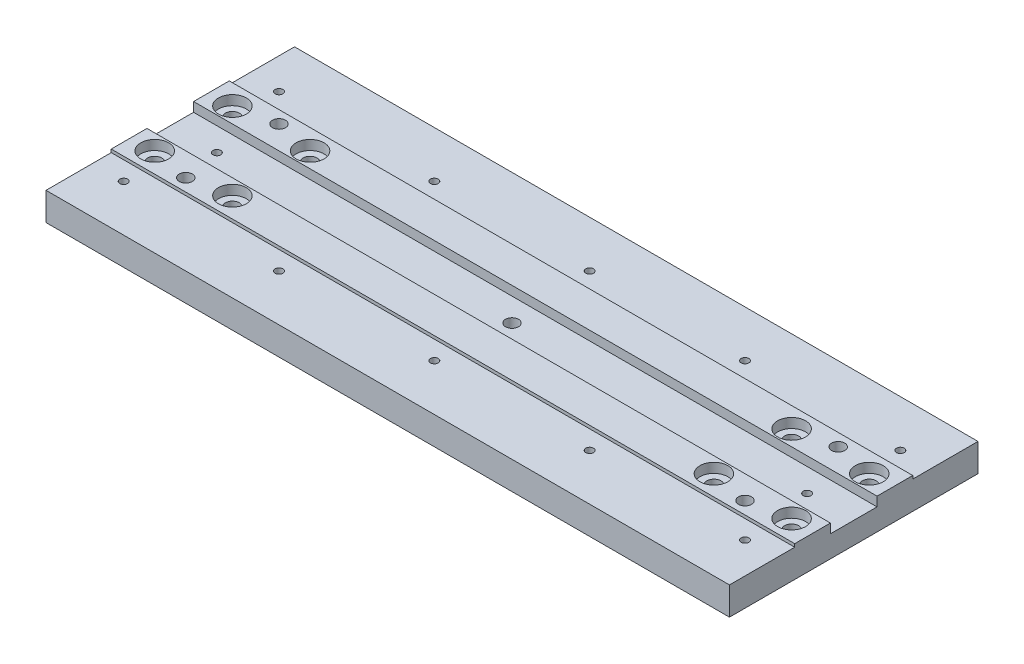
from build123d import *

# Parameters (mm, degrees)
SKIZZE1_W                                            = 220
SKIZZE1_H                                            = 80
AUFSATZ_LINEAR_AUSTRAGEN1_DEPTH                      = 10
STIRNSENKUNG_F_R_M4_FLACHKOPFSCHRAUBE_MI_D           = 4.5
STIRNSENKUNG_F_R_M4_FLACHKOPFSCHRAUBE_MI_DEPTH       = 11.5
STIRNSENKUNG_F_R_M4_FLACHKOPFSCHRAUBE_MI_CBORE_D     = 9
STIRNSENKUNG_F_R_M4_FLACHKOPFSCHRAUBE_MI_CBORE_DEPTH = 3.1
STIRNSENKUNG_F_R_M4_FLACHKOPFSCHRAUBE_MI_TIP         = 1.351936393
M3_GEWINDEBOHRUNG1_AT_2_COUNT                        = 2
M3_GEWINDEBOHRUNG1_AT_2_PITCH                        = 50
M3_GEWINDEBOHRUNG1_AT_3_COUNT                        = 2
M3_GEWINDEBOHRUNG1_AT_3_PITCH                        = 100
M3_GEWINDEBOHRUNG1_AT_4_COUNT                        = 2
M3_GEWINDEBOHRUNG1_AT_4_PITCH                        = 150
M3_GEWINDEBOHRUNG1_AT_5_COUNT                        = 2
M3_GEWINDEBOHRUNG1_AT_5_PITCH                        = 50
M3_GEWINDEBOHRUNG1_AT_6_COUNT                        = 2
M3_GEWINDEBOHRUNG1_AT_6_PITCH                        = 200
M3_GEWINDEBOHRUNG1_AT_7_COUNT                        = 2
M3_GEWINDEBOHRUNG1_AT_7_PITCH                        = 250
SKIZZE8_W                                            = 15
SKIZZE8_H                                            = 3
SCHNITT_LINEAR_AUSTRAGEN1_DEPTH                      = 224.830292856
M5_GEWINDEBOHRUNG1_D                                 = 4.2
SKIZZE13_W                                           = 220
SKIZZE13_H                                           = 21
SCHNITT_LINEAR_AUSTRAGEN2_DEPTH                      = 1
M3_GEWINDEBOHRUNG2_D                                 = 2.5


with BuildPart() as part:
    # Skizze1 → Aufsatz-Linear austragen1 (new body)
    with BuildSketch(Plane(origin=(0, 0, 0), x_dir=(1, 0, 0), z_dir=(0, 1, 0))):
        Rectangle(SKIZZE1_W, SKIZZE1_H)
    extrude(amount=AUFSATZ_LINEAR_AUSTRAGEN1_DEPTH)

    # Stirnsenkung für M4 Flachkopfschraube mit Schlitz1
    with Locations(Plane(origin=(0, 10, 0), x_dir=(1, 0, 0), z_dir=(0, 1, 0))):
        with Locations((-102.5, 12.5), (-77.5, 12.5), (-77.5, -12.5), (-102.5, -12.5), (102.5, -12.5), (77.5, -12.5), (77.5, 12.5), (102.5, 12.5)):
            CounterBoreHole(STIRNSENKUNG_F_R_M4_FLACHKOPFSCHRAUBE_MI_D / 2, STIRNSENKUNG_F_R_M4_FLACHKOPFSCHRAUBE_MI_CBORE_D / 2, STIRNSENKUNG_F_R_M4_FLACHKOPFSCHRAUBE_MI_CBORE_DEPTH, depth=STIRNSENKUNG_F_R_M4_FLACHKOPFSCHRAUBE_MI_DEPTH)
            with Locations((0, 0, -(STIRNSENKUNG_F_R_M4_FLACHKOPFSCHRAUBE_MI_DEPTH + STIRNSENKUNG_F_R_M4_FLACHKOPFSCHRAUBE_MI_TIP / 2))):  # 118° drill point
                Cone(0, STIRNSENKUNG_F_R_M4_FLACHKOPFSCHRAUBE_MI_D / 2, STIRNSENKUNG_F_R_M4_FLACHKOPFSCHRAUBE_MI_TIP, mode=Mode.SUBTRACT)

    # Skizze7 → M3 Gewindebohrung1 (revolve, cut)
    with BuildSketch(Plane(origin=(-50, 10, -25), x_dir=(0, 0, 1), z_dir=(1, 0, 0))):
        Polygon((0, 0), (0, 9.251075774), (1.25, 8.5), (1.25, 0), align=None)
    m3_gewindebohrung1 = revolve(axis=Axis((-50, 16.35, -25), (0, -1, 0)), mode=Mode.SUBTRACT)

    # M3 Gewindebohrung1 at 2: M3 Gewindebohrung1 ×2
    with Locations(*[(i * M3_GEWINDEBOHRUNG1_AT_2_PITCH, 0, 0) for i in range(1, M3_GEWINDEBOHRUNG1_AT_2_COUNT)]):
        add(m3_gewindebohrung1, mode=Mode.SUBTRACT)

    # M3 Gewindebohrung1 at 3: M3 Gewindebohrung1 ×2
    with Locations(*[(i * M3_GEWINDEBOHRUNG1_AT_3_PITCH, 0, 0) for i in range(1, M3_GEWINDEBOHRUNG1_AT_3_COUNT)]):
        add(m3_gewindebohrung1, mode=Mode.SUBTRACT)

    # M3 Gewindebohrung1 at 4: M3 Gewindebohrung1 ×2
    with Locations(*[(i * M3_GEWINDEBOHRUNG1_AT_4_PITCH, 0, 0) for i in range(1, M3_GEWINDEBOHRUNG1_AT_4_COUNT)]):
        add(m3_gewindebohrung1, mode=Mode.SUBTRACT)

    # M3 Gewindebohrung1 at 5: M3 Gewindebohrung1 ×2
    with Locations(*[(-i * M3_GEWINDEBOHRUNG1_AT_5_PITCH, 0, 0) for i in range(1, M3_GEWINDEBOHRUNG1_AT_5_COUNT)]):
        add(m3_gewindebohrung1, mode=Mode.SUBTRACT)

    # M3 Gewindebohrung1 at 6: M3 Gewindebohrung1 ×2
    with Locations(*[(i * M3_GEWINDEBOHRUNG1_AT_6_PITCH, 0, 0) for i in range(1, M3_GEWINDEBOHRUNG1_AT_6_COUNT)]):
        add(m3_gewindebohrung1, mode=Mode.SUBTRACT)

    # M3 Gewindebohrung1 at 7: M3 Gewindebohrung1 ×2
    with Locations(*[(i * M3_GEWINDEBOHRUNG1_AT_7_PITCH, 0, 0) for i in range(1, M3_GEWINDEBOHRUNG1_AT_7_COUNT)]):
        add(m3_gewindebohrung1, mode=Mode.SUBTRACT)

    # Skizze8 → Schnitt-Linear austragen1 (cut, through all)
    with BuildSketch(Plane.ZY.offset(110)):
        with Locations((0, 8.5)):
            Rectangle(SKIZZE8_W, SKIZZE8_H)
    extrude(amount=-SCHNITT_LINEAR_AUSTRAGEN1_DEPTH, mode=Mode.SUBTRACT)

    # Spiegeln1: M3 Gewindebohrung1 across plane
    add(m3_gewindebohrung1.mirror(Plane.XY), mode=Mode.SUBTRACT)

    # Spiegeln1 copy 1 sketch → Spiegeln1 copy 1 (revolve, cut)
    with BuildSketch(Plane(origin=(0, 10, 25), x_dir=(0, 0, -1), z_dir=(1, 0, 0))):
        Polygon((0, 0), (0, -9.251075774), (1.25, -8.5), (1.25, 0), align=None)
    revolve(axis=Axis((0, 16.35, 25), (0, 1, 0)), mode=Mode.SUBTRACT)

    # Spiegeln1 copy 2 sketch → Spiegeln1 copy 2 (revolve, cut)
    with BuildSketch(Plane(origin=(50, 10, 25), x_dir=(0, 0, -1), z_dir=(1, 0, 0))):
        Polygon((0, 0), (0, -9.251075774), (1.25, -8.5), (1.25, 0), align=None)
    revolve(axis=Axis((50, 16.35, 25), (0, 1, 0)), mode=Mode.SUBTRACT)

    # Spiegeln1 copy 3 sketch → Spiegeln1 copy 3 (revolve, cut)
    with BuildSketch(Plane(origin=(100, 10, 25), x_dir=(0, 0, -1), z_dir=(1, 0, 0))):
        Polygon((0, 0), (0, -9.251075774), (1.25, -8.5), (1.25, 0), align=None)
    revolve(axis=Axis((100, 16.35, 25), (0, 1, 0)), mode=Mode.SUBTRACT)

    # Spiegeln1 copy 4 sketch → Spiegeln1 copy 4 (revolve, cut)
    with BuildSketch(Plane(origin=(-100, 10, 25), x_dir=(0, 0, -1), z_dir=(1, 0, 0))):
        Polygon((0, 0), (0, -9.251075774), (1.25, -8.5), (1.25, 0), align=None)
    revolve(axis=Axis((-100, 16.35, 25), (0, 1, 0)), mode=Mode.SUBTRACT)

    # Spiegeln1 copy 5 sketch → Spiegeln1 copy 5 (revolve, cut)
    with BuildSketch(Plane(origin=(150, 10, 25), x_dir=(0, 0, -1), z_dir=(1, 0, 0))):
        Polygon((0, 0), (0, -9.251075774), (1.25, -8.5), (1.25, 0), align=None)
    revolve(axis=Axis((150, 16.35, 25), (0, 1, 0)), mode=Mode.SUBTRACT)

    # Spiegeln1 copy 6 sketch → Spiegeln1 copy 6 (revolve, cut)
    with BuildSketch(Plane(origin=(200, 10, 25), x_dir=(0, 0, -1), z_dir=(1, 0, 0))):
        Polygon((0, 0), (0, -9.251075774), (1.25, -8.5), (1.25, 0), align=None)
    revolve(axis=Axis((200, 16.35, 25), (0, 1, 0)), mode=Mode.SUBTRACT)

    # M5 Gewindebohrung1 (through all)
    with Locations(Plane(origin=(0, 10, 0), x_dir=(1, 0, 0), z_dir=(0, 1, 0))):
        with Locations((90, -15), (90, 15), (-90, 15), (-90, -15), (0, 0)):
            Hole(M5_GEWINDEBOHRUNG1_D / 2)

    # Skizze13 → Schnitt-Linear austragen2 (cut)
    with BuildSketch(Plane(origin=(0, 10, 0), x_dir=(1, 0, 0), z_dir=(0, 1, 0))):
        with Locations((0, -29.5)):
            Rectangle(SKIZZE13_W, SKIZZE13_H)
    schnitt_linear_austragen2 = extrude(amount=-SCHNITT_LINEAR_AUSTRAGEN2_DEPTH, mode=Mode.SUBTRACT)

    # Spiegeln2: Schnitt-Linear austragen2 across plane
    add(schnitt_linear_austragen2.mirror(Plane.XY), mode=Mode.SUBTRACT)

    # M3 Gewindebohrung2 (through all)
    with Locations(Plane(origin=(-95, 7, 0), x_dir=(0, 0, 1), z_dir=(0, 1, 0))):
        with Locations((0, 0)):
            m3_gewindebohrung2 = Hole(M3_GEWINDEBOHRUNG2_D / 2)

    # Spiegeln3: M3 Gewindebohrung2 across plane
    add(m3_gewindebohrung2.mirror(Plane(origin=(0, 0, 0), x_dir=(0, 0, 1), z_dir=(1, 0, 0))), mode=Mode.SUBTRACT)


solid = part.part
